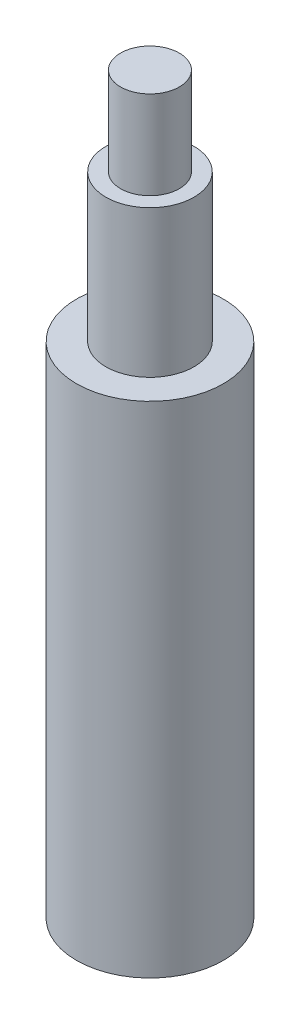
from build123d import *

# Parameters (mm, degrees)
M4_THREAD_BLANK_SKETCH_R = 2
M4_THREAD_BLANK_DEPTH    = 6
LOCATING_SPIGOT_SKETCH_R = 3
LOCATING_SPIGOT_DEPTH    = 10
GUIDE_SHOULDER_SKETCH_R  = 5
GUIDE_SHOULDER_DEPTH     = 34


with BuildPart() as part:
    # M4 Thread Blank Sketch → M4 Thread Blank (new body)
    with BuildSketch(Plane(origin=(0, 140, 0), x_dir=(1, 0, 0), z_dir=(0, 1, 0))):
        with Locations(Location((-20.291651246, 0, 0), (0, 0, 270))):
            Circle(M4_THREAD_BLANK_SKETCH_R)
    extrude(amount=-M4_THREAD_BLANK_DEPTH)

    # Locating Spigot Sketch → Locating Spigot (add)
    with BuildSketch(Plane(origin=(0, 134, 0), x_dir=(1, 0, 0), z_dir=(0, 1, 0))):
        with Locations(Location((-20.291651246, 0, 0), (0, 0, 270))):
            Circle(LOCATING_SPIGOT_SKETCH_R)
    extrude(amount=-LOCATING_SPIGOT_DEPTH)

    # Guide Shoulder Sketch → Guide Shoulder (add)
    with BuildSketch(Plane(origin=(0, 124, 0), x_dir=(1, 0, 0), z_dir=(0, 1, 0))):
        with Locations(Location((-20.291651246, 0, 0), (0, 0, 270))):
            Circle(GUIDE_SHOULDER_SKETCH_R)
    extrude(amount=-GUIDE_SHOULDER_DEPTH)


solid = part.part
